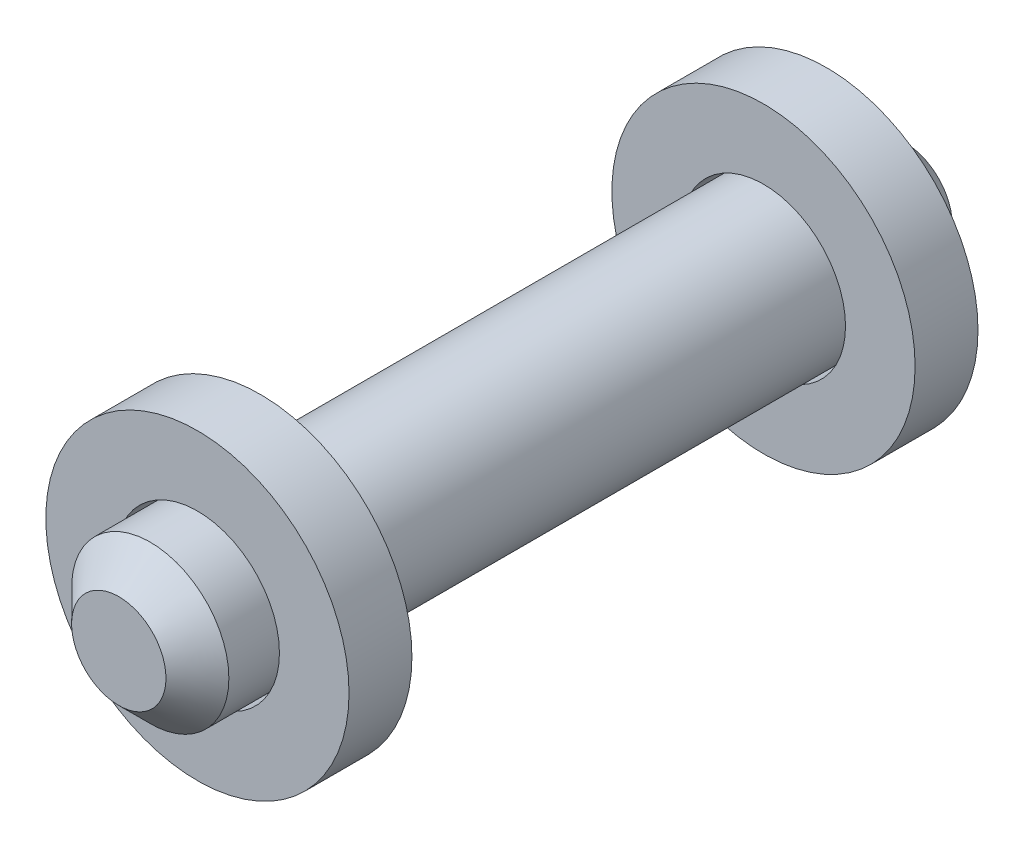
from build123d import *

# Parameters (mm, degrees)
SKETCH1_R           = 2.5
BOSS_EXTRUDE1_DEPTH = 12.5
CHAMFER1_SIZE       = 1
SKETCH2_R           = 4.820793463
SKETCH2_R_2         = 2.607744367
BOSS_EXTRUDE2_DEPTH = 2


with BuildPart() as part:
    # Sketch1 → Boss-Extrude1 (new, symmetric)
    with BuildSketch(Plane.XY):
        Circle(SKETCH1_R)
    extrude(amount=BOSS_EXTRUDE1_DEPTH, both=True)

    # Chamfer1
    chamfer1_edges = [part.edges().sort_by_distance(p)[0] for p in [
        (-2.5, 0, -12.5),
        (-2.5, 0, 12.5),
    ]]
    chamfer(chamfer1_edges, length=CHAMFER1_SIZE)


with BuildPart() as body_2:
    # Sketch2 → Boss-Extrude2 (new body)
    with BuildSketch(Plane.XY.offset(8)):
        Circle(SKETCH2_R)
        Circle(SKETCH2_R_2, mode=Mode.SUBTRACT)
    extrude(amount=BOSS_EXTRUDE2_DEPTH)


with BuildPart() as body_3:
    # Mirror2: mirrored copy
    add(body_2.part.mirror(Plane.XY))


solid = Compound([part.part, body_2.part, body_3.part])
